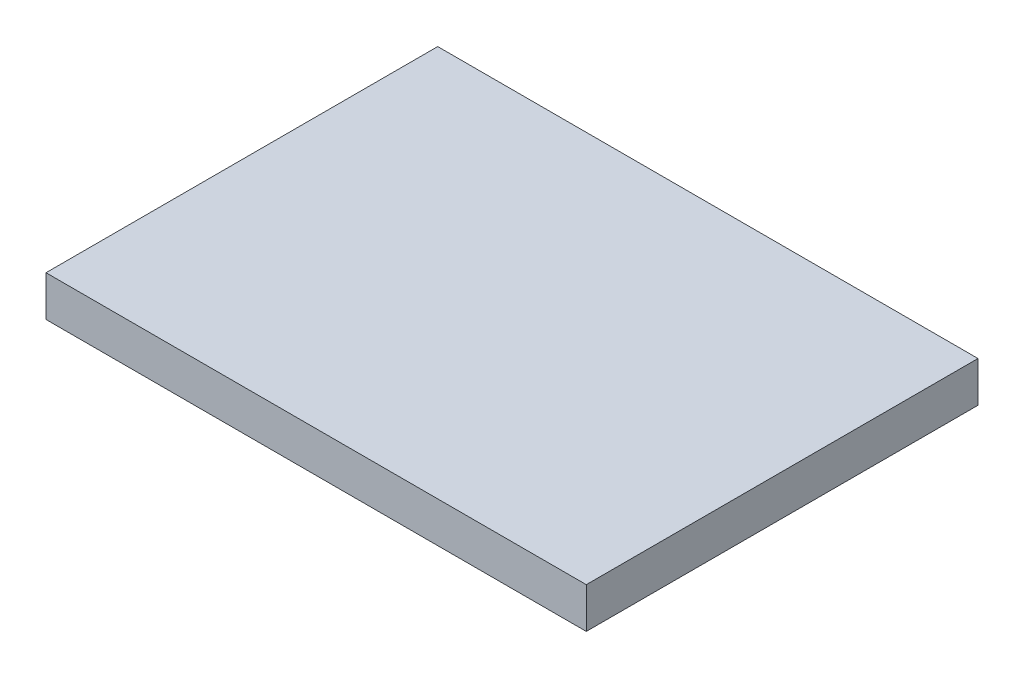
from build123d import *

# Parameters (mm, degrees)
SKETCH1_W           = 80
SKETCH1_H           = 58
BOSS_EXTRUDE1_DEPTH = 6


with BuildPart() as part:
    # Sketch1 → Boss-Extrude1 (new body)
    with BuildSketch(Plane(origin=(0, 0, 0), x_dir=(1, 0, 0), z_dir=(0, 1, 0))):
        Rectangle(SKETCH1_W, SKETCH1_H)
    extrude(amount=BOSS_EXTRUDE1_DEPTH)


solid = part.part
